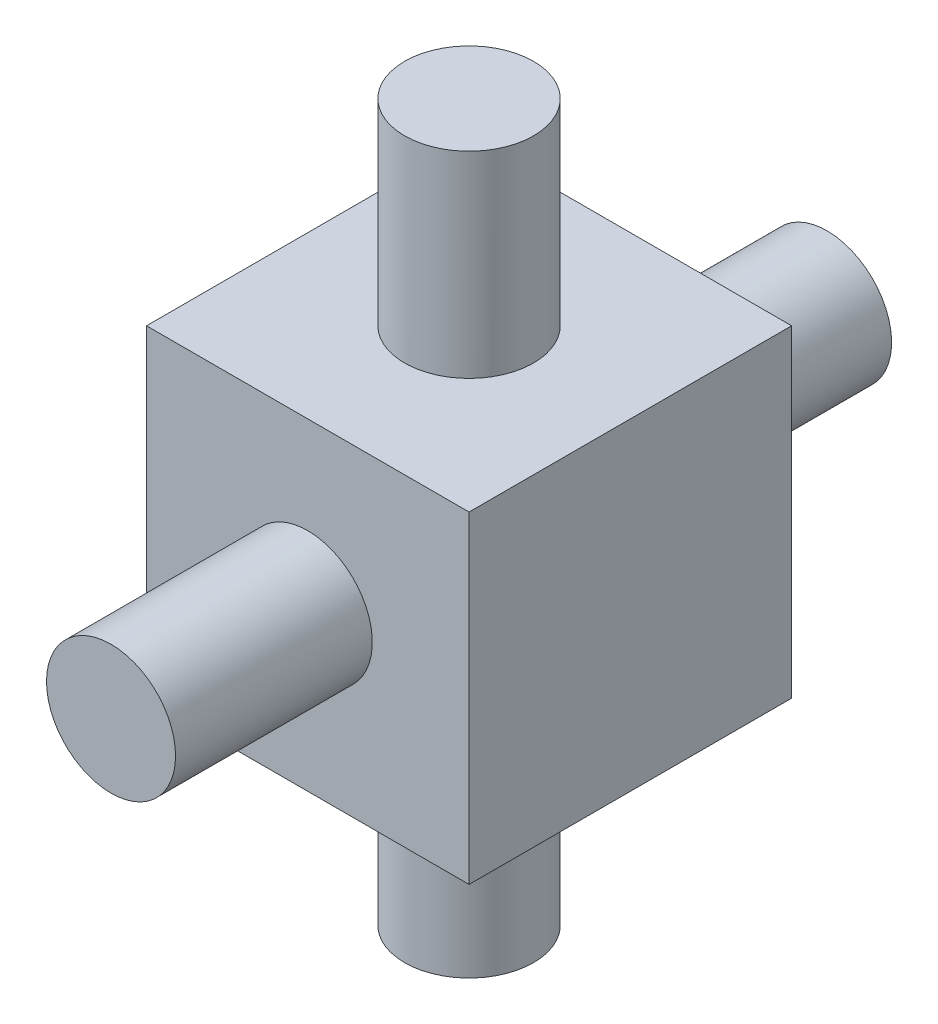
from build123d import *

# Parameters (mm, degrees)
ESQUISSE1_W        = 5
ESQUISSE1_H        = 5
BOSS_EXTRU_1_DEPTH = 5
ESQUISSE2_R        = 1
BOSS_EXTRU_2_DEPTH = 3.05
BOSS_EXTRU_3_START = 3.05
ESQUISSE3_R        = 1
BOSS_EXTRU_3_DEPTH = 3.05
ESQUISSE4_R        = 1
BOSS_EXTRU_4_DEPTH = 3.05
BOSS_EXTRU_5_START = 3.05
ESQUISSE5_R        = 1
BOSS_EXTRU_5_DEPTH = 3.05


with BuildPart() as part:
    # Esquisse1 → Boss.-Extru.1 (new body)
    with BuildSketch(Plane.XY):
        with Locations((2.5, 2.5)):
            Rectangle(ESQUISSE1_W, ESQUISSE1_H)
    extrude(amount=BOSS_EXTRU_1_DEPTH)

    # Esquisse2 → Boss.-Extru.2 (add)
    with BuildSketch(Plane(origin=(0, 5, 0), x_dir=(1, 0, 0), z_dir=(0, 1, 0))):
        with Locations(Location((2.5, -2.5, 0), (0, 0, 90))):
            Circle(ESQUISSE2_R)
    extrude(amount=BOSS_EXTRU_2_DEPTH)

    # Esquisse3 → Boss.-Extru.3 (add)
    with BuildSketch(Plane.XZ.offset(BOSS_EXTRU_3_START)):
        with Locations(Location((2.5, 2.5, 0), (0, 0, 270))):
            Circle(ESQUISSE3_R)
    extrude(amount=-BOSS_EXTRU_3_DEPTH)

    # Esquisse4 → Boss.-Extru.4 (add)
    with BuildSketch(Plane.XY.offset(5)):
        with Locations(Location((2.5, 2.5, 0), (0, 0, 180))):
            Circle(ESQUISSE4_R)
    extrude(amount=BOSS_EXTRU_4_DEPTH)

    # Esquisse5 → Boss.-Extru.5 (add)
    with BuildSketch(Plane(origin=(0, 0, 0), x_dir=(-1, 0, 0), z_dir=(0, 0, -1)).offset(BOSS_EXTRU_5_START)):
        with Locations((-2.5, 2.5)):
            Circle(ESQUISSE5_R)
    extrude(amount=-BOSS_EXTRU_5_DEPTH)


solid = part.part
